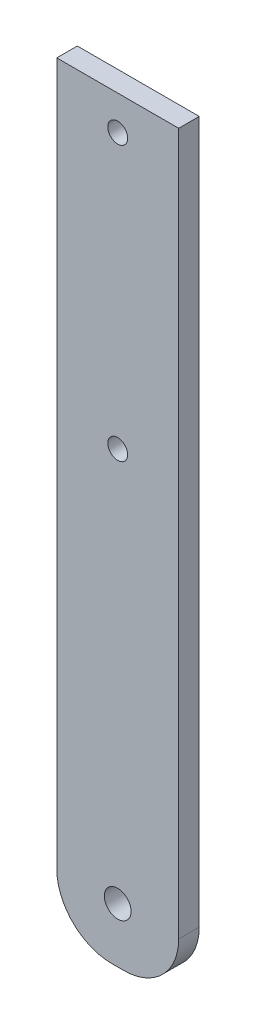
from build123d import *

# Parameters (mm, degrees)
SKETCH_1_W      = 17.8
SKETCH_1_H      = 110.5
SKETCH_1_R      = 1.95
SKETCH_1_R_2    = 1.45
EXTRUDE_1_DEPTH = 3
FILLET_1_R      = 8


with BuildPart() as part:
    # 草图1 → 凸台-拉伸1 (new body)
    with BuildSketch(Plane.XY):
        with Locations((0, 47.25)):
            Rectangle(SKETCH_1_W, SKETCH_1_H)
        Circle(SKETCH_1_R, mode=Mode.SUBTRACT)
        with Locations((0, 57.5)):
            Circle(SKETCH_1_R_2, mode=Mode.SUBTRACT)
        with Locations((0, 97.5)):
            Circle(SKETCH_1_R_2, mode=Mode.SUBTRACT)
    extrude(amount=EXTRUDE_1_DEPTH)

    # 圆角1
    fillet_1_edges = [part.edges().sort_by_distance(p)[0] for p in [
        (8.9, -8, 1.5),
        (-8.9, -8, 1.5),
    ]]
    fillet(fillet_1_edges, radius=FILLET_1_R)


solid = part.part
